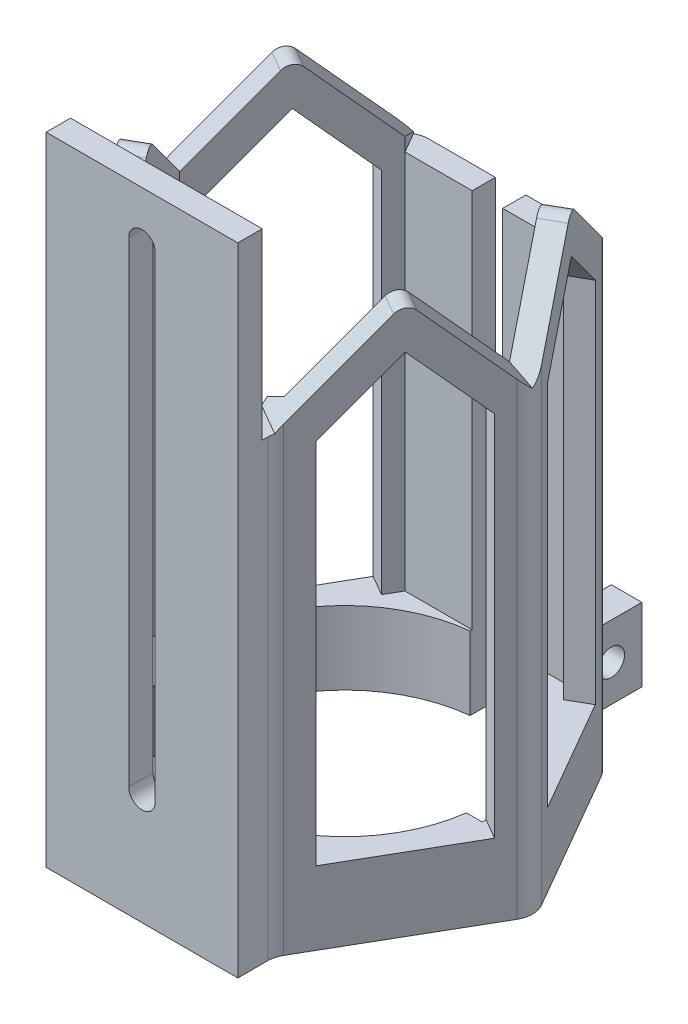
from build123d import *

# Parameters (mm, degrees)
BOSS_EXTRUDE1_DEPTH  = 114.3
SKETCH2_W            = 6.35
SKETCH2_H            = 17.78
CUT_EXTRUDE2_DEPTH   = 99.06
SKETCH3_W            = 27.183356596
SKETCH3_H            = 83.82
CUT_EXTRUDE3_DEPTH   = 99.06
SKETCH4_W            = 27.183356596
SKETCH4_H            = 83.82
CUT_EXTRUDE4_DEPTH   = 99.06
SKETCH7_W            = 3.263536018
SKETCH7_H            = 7.713600016
CUT_EXTRUDE7_DEPTH   = 15.24
CUT_EXTRUDE8_DEPTH   = 99.06
SKETCH10_W           = 39.883356596
SKETCH10_H           = 114.3
BOSS_EXTRUDE2_DEPTH  = 7.62
CUT_EXTRUDE11_DEPTH  = 81.28
BOSS_EXTRUDE9_DEPTH  = 4.826
MIRROR9_COPY_1_DEPTH = 4.826
CUT_EXTRUDE13_DEPTH  = 19.941678176
CUT_EXTRUDE14_DEPTH  = 19.941678176
SKETCH17_W           = 27.183356538
SKETCH17_H           = 4.826
CUT_EXTRUDE15_DEPTH  = 99.06
SKETCH18_W           = 39.883356596
SKETCH18_H           = 7.62
CUT_EXTRUDE16_DEPTH  = 19.941678176
SKETCH20_W           = 27.183356538
SKETCH20_H           = 2.54
CUT_EXTRUDE19_DEPTH  = 79.118321824
FILLET1_R            = 5.08
FILLET2_R            = 2.54
SKETCH21_R           = 2.749999961
CUT_EXTRUDE20_DEPTH  = 79.118321824
SKETCH22_W           = 39.883356596
SKETCH22_H           = 5.08
BOSS_EXTRUDE10_DEPTH = 38.1
CUT_EXTRUDE21_REACH  = 169.333


with BuildPart() as part:
    # Sketch1 → Boss-Extrude1 (new body)
    with BuildSketch(Plane(origin=(0, 0, 0), x_dir=(1, 0, 0), z_dir=(0, 1, 0))):
        with BuildLine():
            Line((39.883356596, 0), (19.941678298, 34.54))
            Line((19.941678298, 34.54), (9.525, 34.54))
            Line((9.525, 34.54), (9.525, 52.32))
            Line((9.525, 52.32), (3.175, 52.32))
            Line((3.175, 52.32), (3.175, 34.54))
            Line((3.175, 34.54), (3.175, 29.28841025))
            ThreePointArc((3.175, 29.28841025), (0, -29.46), (-3.175, 29.28841025))
            Line((-3.175, 29.28841025), (-3.175, 34.54))
            Line((-3.175, 34.54), (-3.175, 52.32))
            Line((-3.175, 52.32), (-9.525, 52.32))
            Line((-9.525, 52.32), (-9.525, 34.54))
            Line((-9.525, 34.54), (-19.941678298, 34.54))
            Line((-19.941678298, 34.54), (-39.883356596, 0))
            Line((-39.883356596, 0), (-19.941678298, -34.54))
            Line((-19.941678298, -34.54), (19.941678298, -34.54))
            Line((19.941678298, -34.54), (39.883356596, 0))
        make_face()
    extrude(amount=BOSS_EXTRUDE1_DEPTH)

    # Sketch2 → Cut-Extrude2 (cut)
    with BuildSketch(Plane(origin=(0, 114.3, 0), x_dir=(1, 0, 0), z_dir=(0, 1, 0))):
        with Locations((-6.35, 43.43)):
            Rectangle(SKETCH2_W, SKETCH2_H)
        with Locations((6.35, 43.43)):
            Rectangle(SKETCH2_W, SKETCH2_H)
    extrude(amount=-CUT_EXTRUDE2_DEPTH, mode=Mode.SUBTRACT)

    # Sketch3 → Cut-Extrude3 (cut)
    with BuildSketch(Plane(origin=(-29.912517447, 0, -17.27), x_dir=(-0.49999999999999617, 0, 0.8660254037844409), z_dir=(-0.8660254037844408, 0, -0.4999999999999961))):
        with Locations((0, 57.15)):
            Rectangle(SKETCH3_W, SKETCH3_H)
    extrude(amount=-CUT_EXTRUDE3_DEPTH, mode=Mode.SUBTRACT)

    # Sketch4 → Cut-Extrude4 (cut)
    with BuildSketch(Plane(origin=(29.912517447, 0, -17.27), x_dir=(-0.500000000000004, 0, -0.8660254037844364), z_dir=(0.8660254037844365, 0, -0.500000000000004))):
        with Locations((0, 57.15)):
            Rectangle(SKETCH4_W, SKETCH4_H)
    extrude(amount=-CUT_EXTRUDE4_DEPTH, mode=Mode.SUBTRACT)

    # Sketch7 → Cut-Extrude7 (cut)
    with BuildSketch(Plane.XZ):
        with Locations((-30.838217531, 0)):
            Rectangle(SKETCH7_W, SKETCH7_H)
        with Locations((30.838217531, 0)):
            Rectangle(SKETCH7_W, SKETCH7_H)
    extrude(amount=-CUT_EXTRUDE7_DEPTH, mode=Mode.SUBTRACT)

    # Sketch8 → Cut-Extrude8 (cut)
    with BuildSketch(Plane(origin=(0, 114.3, 0), x_dir=(1, 0, 0), z_dir=(0, 1, 0))):
        Polygon((-3.175, 29.714), (3.175, 29.714), (17.155385899, 29.714), (34.310771797, 0), (17.155385899, -29.714), (-17.155385899, -29.714), (-34.310771797, 0), (-17.155385899, 29.714), align=None)
    extrude(amount=-CUT_EXTRUDE8_DEPTH, mode=Mode.SUBTRACT)

    # Sketch10 → Boss-Extrude2 (add)
    with BuildSketch(Plane.XY.offset(34.54)):
        with Locations((0, 57.15)):
            Rectangle(SKETCH10_W, SKETCH10_H)
    extrude(amount=BOSS_EXTRUDE2_DEPTH)

    # Sketch12 → Cut-Extrude11 (cut)
    with BuildSketch(Plane(origin=(-29.912517447, 0, -17.27), x_dir=(-0.4999999999999998, 0, 0.8660254037844388), z_dir=(-0.8660254037844388, 0, -0.4999999999999998))):
        Polygon((19.941678298, 114.3), (0, 114.3), (19.941678298, 94.358321702), align=None)
        Polygon((-19.941678298, 94.358321702), (0, 114.3), (-19.941678298, 114.3), align=None)
        Polygon((6.259743879, 99.06), (0, 105.319743879), (-6.259743879, 99.06), align=None)
    cut_extrude11 = extrude(amount=-CUT_EXTRUDE11_DEPTH, mode=Mode.SUBTRACT)

    # Mirror2: Cut-Extrude11 across plane
    add(cut_extrude11.mirror(Plane(origin=(0, 0, 0), x_dir=(0, 0, 1), z_dir=(1, 0, 0))), mode=Mode.SUBTRACT)

    # Sketch11 → Boss-Extrude9 (add)
    with BuildSketch(Plane(origin=(-29.912517447, 0, -17.27), x_dir=(-0.4999999999999998, 0, 0.8660254037844388), z_dir=(-0.8660254037844388, 0, -0.4999999999999998))):
        Polygon((-13.591678298, 91.728065581), (0, 105.319743879), (13.591678298, 91.728065581), (19.941678298, 94.358321702), (0, 114.3), (-19.941678298, 94.358321702), align=None)
    boss_extrude9 = extrude(amount=-BOSS_EXTRUDE9_DEPTH)

    # Mirror8: Boss-Extrude9 across plane
    add(boss_extrude9.mirror(Plane.XY))

    # Mirror9: Boss-Extrude9 across plane
    add(boss_extrude9.mirror(Plane(origin=(0, 0, 0), x_dir=(0, 0, 1), z_dir=(1, 0, 0))))

    # Mirror9 copy 1 sketch → Mirror9 copy 1 (add)
    with BuildSketch(Plane(origin=(29.912517447, 0, 17.27), x_dir=(0.4999999999999998, 0, -0.8660254037844388), z_dir=(0.8660254037844388, 0, 0.4999999999999998))):
        Polygon((-13.591678298, 91.728065581), (0, 105.319743879), (13.591678298, 91.728065581), (19.941678298, 94.358321702), (0, 114.3), (-19.941678298, 94.358321702), align=None)
    extrude(amount=-MIRROR9_COPY_1_DEPTH)

    # Sketch15 → Cut-Extrude13 (cut)
    with BuildSketch(Plane(origin=(0, 114.3, 0), x_dir=(1, 0, 0), z_dir=(0, 1, 0))):
        Polygon((-17.155385899, 29.714), (-19.941678298, 34.54), (19.941678298, 34.54), (17.155385899, 29.714), align=None)
    extrude(amount=-CUT_EXTRUDE13_DEPTH, mode=Mode.SUBTRACT)

    # Sketch16 → Cut-Extrude14 (cut)
    with BuildSketch(Plane(origin=(0, 114.3, 0), x_dir=(1, 0, 0), z_dir=(0, 1, 0))):
        Polygon((-19.941678298, -34.54), (19.941678298, -34.54), (11.5828011, -29.714), (-11.5828011, -29.714), align=None)
    extrude(amount=-CUT_EXTRUDE14_DEPTH, mode=Mode.SUBTRACT)

    # Sketch17 → Cut-Extrude15 (cut)
    with BuildSketch(Plane(origin=(0, 114.3, 0), x_dir=(1, 0, 0), z_dir=(0, 1, 0))):
        with Locations((0, -32.127)):
            Rectangle(SKETCH17_W, SKETCH17_H)
    extrude(amount=-CUT_EXTRUDE15_DEPTH, mode=Mode.SUBTRACT)

    # Sketch18 → Cut-Extrude16 (cut)
    with BuildSketch(Plane(origin=(0, 114.3, 0), x_dir=(1, 0, 0), z_dir=(0, 1, 0))):
        with Locations((0, -38.35)):
            Rectangle(SKETCH18_W, SKETCH18_H)
    extrude(amount=-CUT_EXTRUDE16_DEPTH, mode=Mode.SUBTRACT)

    # Sketch20 → Cut-Extrude19 (cut)
    with BuildSketch(Plane(origin=(0, 94.358321824, 0), x_dir=(1, 0, 0), z_dir=(0, 1, 0))):
        with Locations((0, -35.81)):
            Rectangle(SKETCH20_W, SKETCH20_H)
    extrude(amount=-CUT_EXTRUDE19_DEPTH, mode=Mode.SUBTRACT)

    # Fillet1
    fillet1_edges = [part.edges().sort_by_distance(p)[0] for p in [
        (19.941678298, 47.179160851, 34.54),
        (-39.883356596, 47.179160851, 0),
        (-19.941678298, 47.179160851, -34.54),
        (39.883356596, 47.179160851, 0),
        (-19.941678298, 47.179160851, 34.54),
        (19.941678298, 47.179160851, -34.54),
        (-9.525, 7.62, -34.54),
        (9.525, 7.62, -34.54),
    ]]
    fillet(fillet1_edges, radius=FILLET1_R)

    # Fillet2
    fillet2_edges = [part.edges().sort_by_distance(p)[0] for p in [
        (27.822798147, 114.3, 16.0635),
        (-27.822798147, 114.3, -16.0635),
        (-27.822798147, 114.3, 16.0635),
        (27.822798147, 114.3, -16.0635),
    ]]
    fillet(fillet2_edges, radius=FILLET2_R)

    # Sketch21 → Cut-Extrude20 (cut)
    with BuildSketch(Plane(origin=(9.525, 0, 0), x_dir=(0, 0, -1), z_dir=(1, 0, 0))):
        with Locations((45.97, 7.62)):
            Circle(SKETCH21_R)
    extrude(amount=-CUT_EXTRUDE20_DEPTH, mode=Mode.SUBTRACT)

    # Sketch22 → Boss-Extrude10 (add)
    with BuildSketch(Plane(origin=(0, 94.358321824, 0), x_dir=(1, 0, 0), z_dir=(0, 1, 0))):
        with Locations((0, -39.62)):
            Rectangle(SKETCH22_W, SKETCH22_H)
    extrude(amount=BOSS_EXTRUDE10_DEPTH)

    # Sketch23 → Cut-Extrude21 (cut, up to next)
    with BuildSketch(Plane.XY.offset(42.16), mode=Mode.PRIVATE) as cut_extrude21_sk1:
        with BuildLine():
            Line((2.75, 122.13), (2.75, 23.07))
            ThreePointArc((2.75, 23.07), (0, 20.32), (-2.75, 23.07))
            Line((-2.75, 23.07), (-2.75, 122.13))
            ThreePointArc((-2.75, 122.13), (0, 124.88), (2.75, 122.13))
        make_face()
    cut_extrude21_tool1 = extrude(cut_extrude21_sk1.sketch, amount=-CUT_EXTRUDE21_REACH, mode=Mode.PRIVATE) & part.part
    add(cut_extrude21_tool1.solids().sort_by_distance((0, 72.6, 42.16))[0], mode=Mode.SUBTRACT)


solid = part.part
